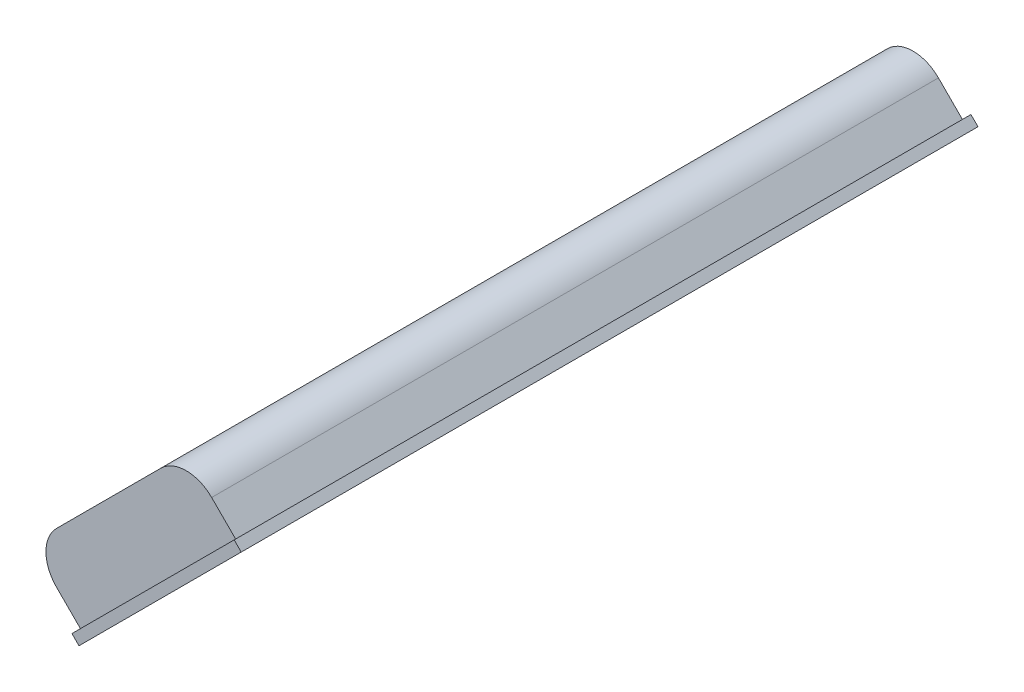
from build123d import *

# Parameters (mm, degrees)
COVER_START       = -397
COVER_DEPTH       = 437.1
RAIL_START        = -400
RAIL_FLANGE_DEPTH = 443.1


with BuildPart() as part:
    # Sketch1 → Cover (new body)
    with BuildSketch(Plane.XY.offset(COVER_START)):
        with BuildLine():
            Line((-193.711902706, 287.049997823), (-287.049997823, 193.711902706))
            Line((-287.049997823, 193.711902706), (-305.717616846, 212.379521729))
            ThreePointArc((-305.717616846, 212.379521729), (-312.044110372, 227.653028203), (-305.717616846, 242.926534677))
            Line((-305.717616846, 242.926534677), (-242.926534677, 305.717616846))
            ThreePointArc((-242.926534677, 305.717616846), (-227.653028203, 312.044110372), (-212.379521729, 305.717616846))
            Line((-212.379521729, 305.717616846), (-193.711902706, 287.049997823))
        make_face()
    extrude(amount=COVER_DEPTH)

    # Sketch2 → Rail Flange (add)
    with BuildSketch(Plane.XY.offset(RAIL_START)):
        Polygon((-191.590582362, 289.171318166), (-289.171318166, 191.590582362), (-293.413958853, 195.83322305), (-195.83322305, 293.413958853), align=None)
    extrude(amount=RAIL_FLANGE_DEPTH)


solid = part.part
